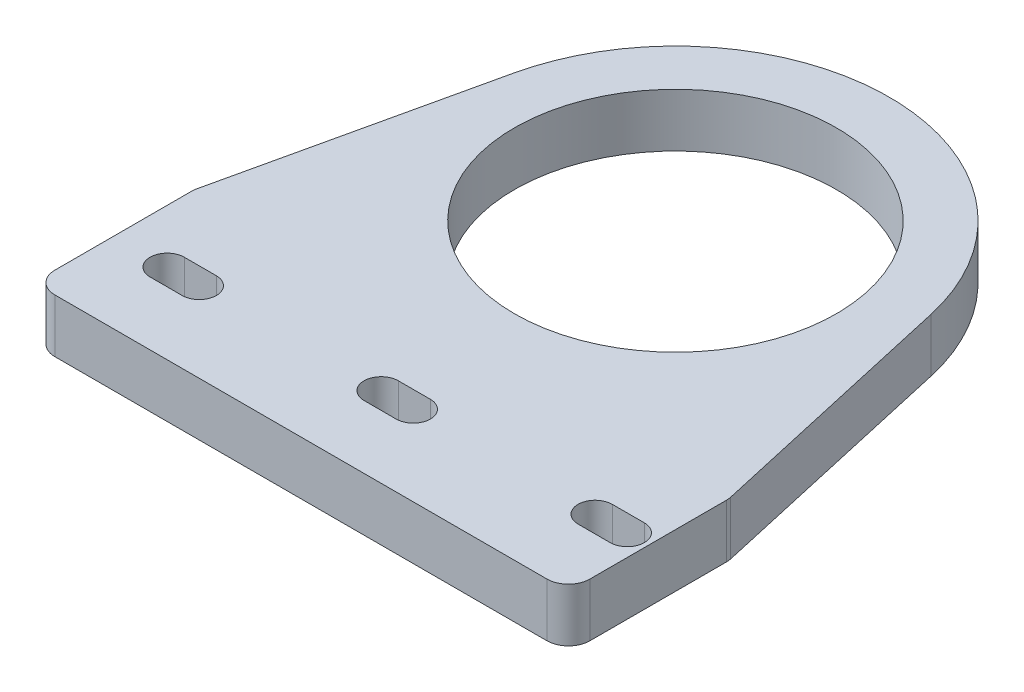
from build123d import *

# Parameters (mm, degrees)
SKETCH_1_R          = 20
SKETCH_1_R_2        = 6.5
SKETCH_1_R_3        = 1.6
EXTRUDE_1_DEPTH     = 5
SKETCH_2_W          = 50
SKETCH_2_H          = 15
SKETCH_2_R          = 1.6
EXTRUDE_2_DEPTH     = 5
EXTRUDE_START       = -5
EXTRUDE_4_DEPTH     = 5
SKETCH_5_R          = 3.5
CUT_EXTRUDE_1_DEPTH = 3
FILLET_1_R          = 2
SKETCH_6_R          = 15.05
CUT_EXTRUDE_2_DEPTH = 44.301270189
CUT_EXTRUDE_3_DEPTH = 44.301270189


with BuildPart() as part:
    # 草图1 → 凸台-拉伸1 (new body)
    with BuildSketch(Plane(origin=(0, 0, 0), x_dir=(1, 0, 0), z_dir=(0, 1, 0))):
        with Locations(Location((0, 0, 0), (0, 0, 270))):
            Circle(SKETCH_1_R)
        with Locations(Location((0, 0, 0), (0, 0, 270))):
            Circle(SKETCH_1_R_2, mode=Mode.SUBTRACT)
        with Locations(Location((0, 9.5, 0), (0, 0, 270))):
            Circle(SKETCH_1_R_3, mode=Mode.SUBTRACT)
        with Locations(Location((8.227241336, -4.75, 0), (0, 0, 270))):
            Circle(SKETCH_1_R_3, mode=Mode.SUBTRACT)
        with Locations(Location((-8.227241336, -4.75, 0), (0, 0, 270))):
            Circle(SKETCH_1_R_3, mode=Mode.SUBTRACT)
    extrude(amount=EXTRUDE_1_DEPTH)



with BuildPart() as body_2:
    # 草图2 → 凸台-拉伸2 (new body)
    with BuildSketch(Plane(origin=(0, 5, 0), x_dir=(1, 0, 0), z_dir=(0, 1, 0))):
        with Locations((0, -27.5)):
            Rectangle(SKETCH_2_W, SKETCH_2_H)
        with Locations(Location((-20, -27.5, 0), (0, 0, 270))):
            Circle(SKETCH_2_R, mode=Mode.SUBTRACT)
        with Locations(Location((20, -27.5, 0), (0, 0, 270))):
            Circle(SKETCH_2_R, mode=Mode.SUBTRACT)
        with Locations(Location((0, -27.5, 0), (0, 0, 270))):
            Circle(SKETCH_2_R, mode=Mode.SUBTRACT)
    extrude(amount=-EXTRUDE_2_DEPTH)


with BuildPart() as part_1:
    add(part.part)

    add(body_2.part)  # 凸台-拉伸4 merges body 2
    # 草图4 → 凸台-拉伸4 (add)
    with BuildSketch(Plane(origin=(0, 5, 0), x_dir=(1, 0, 0), z_dir=(0, 1, 0)).offset(EXTRUDE_START)):
        with BuildLine():
            Line((-19.512195122, 4.390243902), (-25, -20))
            Line((-25, -20), (0, -20))
            ThreePointArc((0, -20), (-15.617376189, -12.493900951), (-19.512195122, 4.390243902))
        make_face()
        with BuildLine():
            ThreePointArc((20, 0), (14.142135624, -14.142135624), (0, -20))
            Line((0, -20), (25, -20))
            Line((25, -20), (19.512195122, 4.390243902))
            ThreePointArc((19.512195122, 4.390243902), (19.877674693, 2.208630521), (20, 0))
        make_face()
    extrude(amount=EXTRUDE_4_DEPTH)

    # 草图5 → 切除-拉伸1 (cut)
    with BuildSketch(Plane(origin=(0, 5, 0), x_dir=(1, 0, 0), z_dir=(0, 1, 0))):
        with Locations((-8.227241336, -4.75)):
            Circle(SKETCH_5_R)
        with Locations((8.227241336, -4.75)):
            Circle(SKETCH_5_R)
        with Locations((0, 9.5)):
            Circle(SKETCH_5_R)
    extrude(amount=-CUT_EXTRUDE_1_DEPTH, mode=Mode.SUBTRACT)

    # 圆角1
    fillet_1_edges = [part_1.edges().sort_by_distance(p)[0] for p in [
        (-25, 2.5, 20),
        (25, 2.5, 20),
        (25, 2.5, 35),
        (-25, 2.5, 35),
    ]]
    fillet(fillet_1_edges, radius=FILLET_1_R)

    # 草图6 → 切除-拉伸2 (cut, through all)
    with BuildSketch(Plane(origin=(0, 5, 0), x_dir=(1, 0, 0), z_dir=(0, 1, 0))):
        with Locations(Location((0, 0, 0), (0, 0, 270))):
            Circle(SKETCH_6_R)
    extrude(amount=-CUT_EXTRUDE_2_DEPTH, mode=Mode.SUBTRACT)

    # 草图7 → 切除-拉伸3 (cut, through all)
    with BuildSketch(Plane(origin=(0, 5, 0), x_dir=(1, 0, 0), z_dir=(0, 1, 0))):
        with BuildLine():
            Line((-20, -25.9), (-17, -25.9))
            ThreePointArc((-17, -25.9), (-15.4, -27.5), (-17, -29.1))
            Line((-17, -29.1), (-20, -29.1))
            ThreePointArc((-20, -29.1), (-21.6, -27.5), (-20, -25.9))
        make_face()
        with BuildLine():
            Line((0, -25.9), (3, -25.9))
            ThreePointArc((3, -25.9), (4.6, -27.5), (3, -29.1))
            Line((3, -29.1), (0, -29.1))
            ThreePointArc((0, -29.1), (-1.6, -27.5), (0, -25.9))
        make_face()
        with BuildLine():
            Line((20, -25.9), (23, -25.9))
            ThreePointArc((23, -25.9), (24.6, -27.5), (23, -29.1))
            Line((23, -29.1), (20, -29.1))
            ThreePointArc((20, -29.1), (18.4, -27.5), (20, -25.9))
        make_face()
    extrude(amount=-CUT_EXTRUDE_3_DEPTH, mode=Mode.SUBTRACT)


solid = part_1.part
